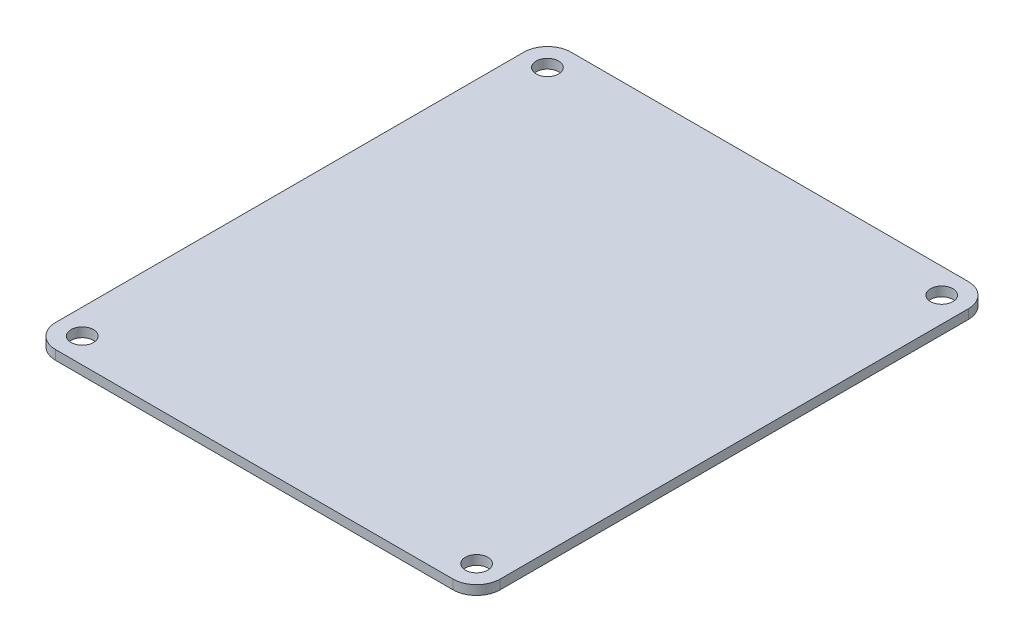
from build123d import *

# Parameters (mm, degrees)
SKETCH1_W           = 75.3
SKETCH1_H           = 87.3
BOSS_EXTRUDE1_DEPTH = 1.5875
SKETCH2_R           = 1.9
CUT_EXTRUDE1_DEPTH  = 1.5875
FILLET1_R           = 4


with BuildPart() as part:
    # Sketch1 → Boss-Extrude1 (new body)
    with BuildSketch(Plane(origin=(0, 0, 0), x_dir=(1, 0, 0), z_dir=(0, 1, 0))):
        with Locations((0, -32.364818223)):
            Rectangle(SKETCH1_W, SKETCH1_H)
    extrude(amount=BOSS_EXTRUDE1_DEPTH)

    # Sketch2 → Cut-Extrude1 (cut)
    with BuildSketch(Plane(origin=(0, 0, 0), x_dir=(1, 0, 0), z_dir=(0, 1, 0))):
        with Locations(Location((33.4, -71.764818223, 0), (0, 0, 270))):
            Circle(SKETCH2_R)
        with Locations(Location((-33.4, -71.764818223, 0), (0, 0, 270))):
            Circle(SKETCH2_R)
        with Locations(Location((-33.4, 7.035181777, 0), (0, 0, 270))):
            Circle(SKETCH2_R)
        with Locations(Location((33.4, 7.035181777, 0), (0, 0, 270))):
            Circle(SKETCH2_R)
    extrude(amount=CUT_EXTRUDE1_DEPTH, mode=Mode.SUBTRACT)

    # Fillet1
    fillet1_edges = [part.edges().sort_by_distance(p)[0] for p in [
        (-37.65, 0.79375, -11.285181777),
        (37.65, 0.79375, -11.285181777),
        (37.65, 0.79375, 76.014818223),
        (-37.65, 0.79375, 76.014818223),
    ]]
    fillet(fillet1_edges, radius=FILLET1_R)


solid = part.part
